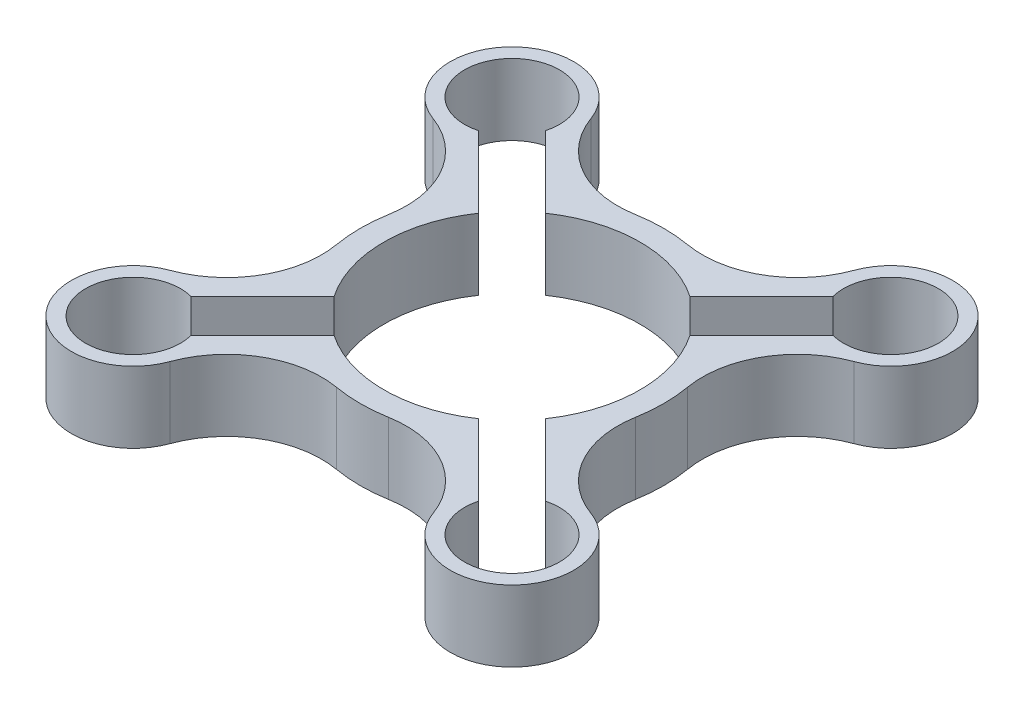
from build123d import *

# Parameters (mm, degrees)
SKETCH1_R           = 27
BOSS_EXTRUDE1_DEPTH = 15
CUT_EXTRUDE1_START  = -15
CUT_EXTRUDE1_DEPTH  = 15


with BuildPart() as part:
    # Sketch1 → Boss-Extrude1 (new body)
    with BuildSketch(Plane(origin=(0, 0, 0), x_dir=(1, 0, 0), z_dir=(0, 1, 0))):
        with BuildLine():
            ThreePointArc((-31.523820357, 5.499886369), (-32, 0), (-31.523820357, -5.499886369))
            ThreePointArc((-31.523820357, -5.499886369), (-33.916662735, -18.956279365), (-44.393071751, -27.733810979))
            ThreePointArc((-44.393071751, -27.733810979), (-49.143921292, -49.143921292), (-27.733810979, -44.393071751))
            ThreePointArc((-27.733810979, -44.393071751), (-18.956279365, -33.916662735), (-5.499886369, -31.523820357))
            ThreePointArc((-5.499886369, -31.523820357), (0, -32), (5.499886369, -31.523820357))
            ThreePointArc((5.499886369, -31.523820357), (18.956279365, -33.916662735), (27.733810979, -44.393071751))
            ThreePointArc((27.733810979, -44.393071751), (49.143921292, -49.143921292), (44.393071751, -27.733810979))
            ThreePointArc((44.393071751, -27.733810979), (33.916662735, -18.956279365), (31.523820357, -5.499886369))
            ThreePointArc((31.523820357, -5.499886369), (32, 0), (31.523820357, 5.499886369))
            ThreePointArc((31.523820357, 5.499886369), (33.916662735, 18.956279365), (44.393071751, 27.733810979))
            ThreePointArc((44.393071751, 27.733810979), (49.143921292, 49.143921292), (27.733810979, 44.393071751))
            ThreePointArc((27.733810979, 44.393071751), (18.956279365, 33.916662735), (5.499886369, 31.523820357))
            ThreePointArc((5.499886369, 31.523820357), (0, 32), (-5.499886369, 31.523820357))
            ThreePointArc((-5.499886369, 31.523820357), (-18.956279365, 33.916662735), (-27.733810979, 44.393071751))
            ThreePointArc((-27.733810979, 44.393071751), (-49.143921292, 49.143921292), (-44.393071751, 27.733810979))
            ThreePointArc((-44.393071751, 27.733810979), (-33.916662735, 18.956279365), (-31.523820357, 5.499886369))
        make_face()
        with Locations(Location((0, 0, 0), (0, 0, 270))):
            Circle(SKETCH1_R, mode=Mode.SUBTRACT)
    extrude(amount=BOSS_EXTRUDE1_DEPTH)

    # Sketch2 → Cut-Extrude1 (cut)
    with BuildSketch(Plane(origin=(0, 15, 0), x_dir=(1, 0, 0), z_dir=(0, 1, 0)).offset(CUT_EXTRUDE1_START)):
        with BuildLine():
            Line((15.226129133, 22.297196945), (30.292274874, 37.363342686))
            ThreePointArc((30.292274874, 37.363342686), (47.022600949, 47.022600949), (37.363342686, 30.292274874))
            Line((37.363342686, 30.292274874), (22.297196945, 15.226129133))
            ThreePointArc((22.297196945, 15.226129133), (27, 0), (22.297196945, -15.226129133))
            Line((22.297196945, -15.226129133), (37.363342686, -30.292274874))
            ThreePointArc((37.363342686, -30.292274874), (47.022600949, -47.022600949), (30.292274874, -37.363342686))
            Line((30.292274874, -37.363342686), (15.226129133, -22.297196945))
            ThreePointArc((15.226129133, -22.297196945), (0, -27), (-15.226129133, -22.297196945))
            Line((-15.226129133, -22.297196945), (-30.292274874, -37.363342686))
            ThreePointArc((-30.292274874, -37.363342686), (-47.022600949, -47.022600949), (-37.363342686, -30.292274874))
            Line((-37.363342686, -30.292274874), (-22.297196945, -15.226129133))
            ThreePointArc((-22.297196945, -15.226129133), (-27, 0), (-22.297196945, 15.226129133))
            Line((-22.297196945, 15.226129133), (-37.363342686, 30.292274874))
            ThreePointArc((-37.363342686, 30.292274874), (-47.022600949, 47.022600949), (-30.292274874, 37.363342686))
            Line((-30.292274874, 37.363342686), (-15.226129133, 22.297196945))
            ThreePointArc((-15.226129133, 22.297196945), (0, 27), (15.226129133, 22.297196945))
        make_face()
    extrude(amount=CUT_EXTRUDE1_DEPTH, mode=Mode.SUBTRACT)


solid = part.part
